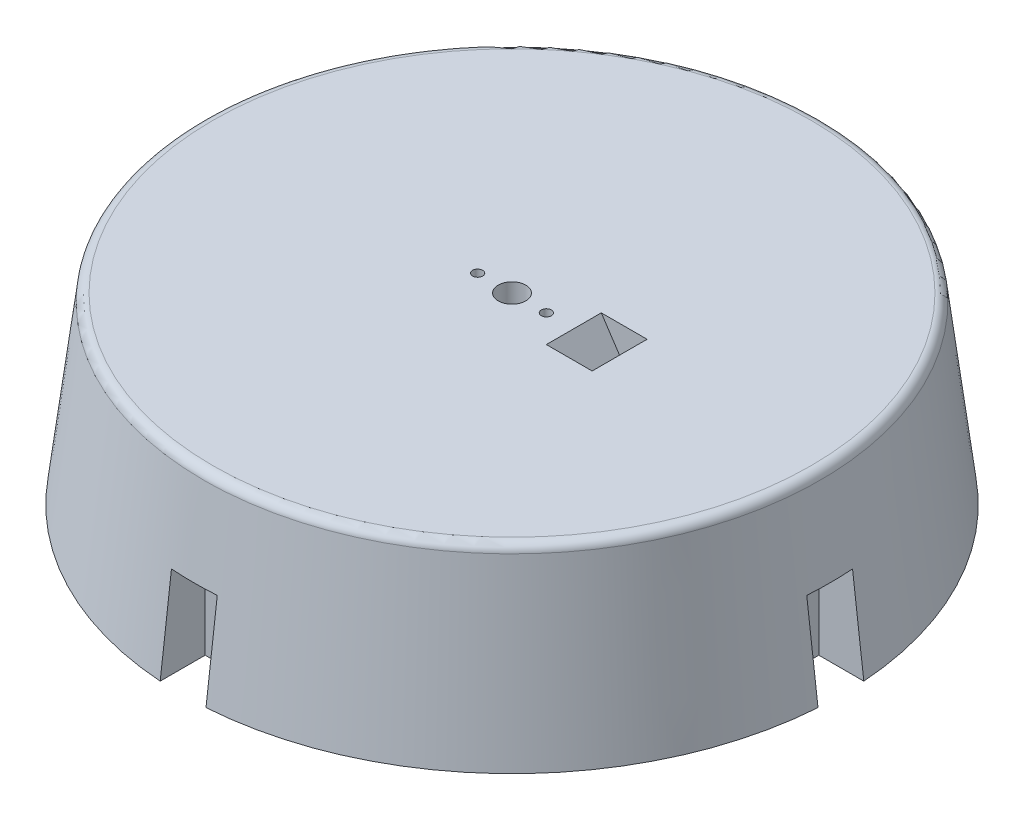
from build123d import *

# Parameters (mm, degrees)
ESQUISSE3_R                  = 72
BOSS_EXTRU_1_DEPTH           = 40
BOSS_EXTRU_1_TAPER           = 7
CONG_2_R                     = 2
ESQUISSE26_R                 = 7.5
ENL_V_MAT_EXTRU_1_DEPTH      = 4
ESQUISSE39_W                 = 10
ESQUISSE39_H                 = 10
ENL_V_MAT_EXTRU_4_DEPTH      = 20
D_GAGEMENT_M2_51_AT_2_COUNT  = 2
D_GAGEMENT_M2_51_AT_2_PITCH  = 10
R_P_TITION_CIRCULAIRE5_COUNT = 4
D_GAGEMENT_M21_D             = 2.2
D_GAGEMENT_M21_DEPTH         = 7
D_GAGEMENT_M21_TIP           = 0.660946681
ENL_V_MAT_EXTRU_2_DEPTH      = 15
ESQUISSE33_R                 = 2
ENL_V_MAT_EXTRU_3_DEPTH      = 105.608795203
ESQUISSE36_W                 = 10
ESQUISSE36_H                 = 12
PASSAGE_DE_CABLE_DEPTH       = 132.153294527
ETOILE_DEPTH                 = 4


with BuildPart() as part:
    # Esquisse3 → Boss.-Extru.1 (new body)
    with BuildSketch(Plane(origin=(0, 0, 0), x_dir=(1, 0, 0), z_dir=(0, 1, 0))):
        Circle(ESQUISSE3_R)
    extrude(amount=BOSS_EXTRU_1_DEPTH, taper=BOSS_EXTRU_1_TAPER)

    # Congé2
    cong_2_edges = [part.edges().sort_by_distance(p)[0] for p in [
        (-67.088617564, 40, 0),
    ]]
    fillet(cong_2_edges, radius=CONG_2_R)

    # Esquisse26 → Enlèv. mat.-Extru.1 (cut)
    with BuildSketch(Plane(origin=(0, 0, 0), x_dir=(-1, 0, 0), z_dir=(0, -1, 0))):
        with Locations(Location((0, 0, 0), (0, 0, 90))):
            Circle(ESQUISSE26_R)
    extrude(amount=-ENL_V_MAT_EXTRU_1_DEPTH, mode=Mode.SUBTRACT)

    # Esquisse39 → Enlèv. mat.-Extru.4 (cut)
    with BuildSketch(Plane.XZ):
        with Locations((67, 0)):
            Rectangle(ESQUISSE39_W, ESQUISSE39_H)
    enl_v_mat_extru_4 = extrude(amount=-ENL_V_MAT_EXTRU_4_DEPTH, mode=Mode.SUBTRACT)

    # Esquisse42 → Dégagement M2.51 (revolve, cut)
    with BuildSketch(Plane(origin=(62, 15, 0), x_dir=(0, 0, -1), z_dir=(0, 1, 0))):
        Polygon((0, 0), (0, 4.811161836), (1.35, 4), (1.35, 0), align=None)
    d_gagement_m2_51 = revolve(axis=Axis((68.35, 15, 0), (-1, 0, 0)), mode=Mode.SUBTRACT)

    # Dégagement M2.51 at 2: Dégagement M2.51 ×2
    with Locations(*[(0, -i * D_GAGEMENT_M2_51_AT_2_PITCH, 0) for i in range(1, D_GAGEMENT_M2_51_AT_2_COUNT)]):
        add(d_gagement_m2_51, mode=Mode.SUBTRACT)

    # Répétition circulaire5: Enlèv. mat.-Extru.4, Dégagement M2.51 ×4 about axis
    r_p_tition_circulaire5_axis = Axis((0, 0, 0), (0, 1, 0))
    add([enl_v_mat_extru_4.rotate(r_p_tition_circulaire5_axis, i * 360 / R_P_TITION_CIRCULAIRE5_COUNT) for i in range(1, R_P_TITION_CIRCULAIRE5_COUNT)], mode=Mode.SUBTRACT)
    add([d_gagement_m2_51.rotate(r_p_tition_circulaire5_axis, i * 360 / R_P_TITION_CIRCULAIRE5_COUNT) for i in range(1, R_P_TITION_CIRCULAIRE5_COUNT)], mode=Mode.SUBTRACT)

    # Répétition circulaire5 copy 1 sketch → Répétition circulaire5 copy 1 (revolve, cut)
    with BuildSketch(Plane(origin=(0, 5, -62), x_dir=(-1, 0, 0), z_dir=(0, 1, 0))):
        Polygon((0, 0), (0, 4.811161836), (1.35, 4), (1.35, 0), align=None)
    revolve(axis=Axis((0, 5, -68.35), (0, 0, 1)), mode=Mode.SUBTRACT)

    # Répétition circulaire5 copy 2 sketch → Répétition circulaire5 copy 2 (revolve, cut)
    with BuildSketch(Plane(origin=(-62, 5, 0), x_dir=(0, 0, 1), z_dir=(0, 1, 0))):
        Polygon((0, 0), (0, 4.811161836), (1.35, 4), (1.35, 0), align=None)
    revolve(axis=Axis((-68.35, 5, 0), (1, 0, 0)), mode=Mode.SUBTRACT)

    # Répétition circulaire5 copy 3 sketch → Répétition circulaire5 copy 3 (revolve, cut)
    with BuildSketch(Plane(origin=(0, 5, 62), x_dir=(1, 0, 0), z_dir=(0, 1, 0))):
        Polygon((0, 0), (0, 4.811161836), (1.35, 4), (1.35, 0), align=None)
    revolve(axis=Axis((0, 5, 68.35), (0, 0, -1)), mode=Mode.SUBTRACT)

    # Dégagement M21
    with Locations(Plane(origin=(0, 40, 0), x_dir=(1, 0, 0), z_dir=(0, 1, 0))):
        with Locations((7.5, 0), (-7.5, 0)):
            Hole(D_GAGEMENT_M21_D / 2, depth=D_GAGEMENT_M21_DEPTH)
            with Locations((0, 0, -(D_GAGEMENT_M21_DEPTH + D_GAGEMENT_M21_TIP / 2))):  # 118° drill point
                Cone(0, D_GAGEMENT_M21_D / 2, D_GAGEMENT_M21_TIP, mode=Mode.SUBTRACT)

    # Esquisse30 → Enlèv. mat.-Extru.2 (cut)
    with BuildSketch(Plane(origin=(0, 40, 0), x_dir=(1, 0, 0), z_dir=(0, 1, 0))):
        with BuildLine():
            ThreePointArc((-3, 0), (0, -3), (3, 0))
            Line((3, 0), (-3, 0))
        make_face()
        with BuildLine():
            Line((-3, 0), (3, 0))
            ThreePointArc((3, 0), (0, 3), (-3, 0))
        make_face()
    extrude(amount=-ENL_V_MAT_EXTRU_2_DEPTH, mode=Mode.SUBTRACT)

    # Esquisse33 → Enlèv. mat.-Extru.3 (cut, through all)
    with BuildSketch(Plane(origin=(0, 25, 0), x_dir=(1, 0, 0), z_dir=(0, 1, 0))):
        with Locations(Location((0, 0, 0), (0, 0, 270))):
            Circle(ESQUISSE33_R)
    extrude(amount=-ENL_V_MAT_EXTRU_3_DEPTH, mode=Mode.SUBTRACT)

    # Esquisse36 → Passage de cable (cut, through all, along a direction that is not the sketch's normal)
    with BuildSketch(Plane.XZ):
        with Locations((45, 0)):
            Rectangle(ESQUISSE36_W, ESQUISSE36_H)
    extrude(amount=-PASSAGE_DE_CABLE_DEPTH, dir=(0.5522931199127548, -0.8336499923211392, 0), mode=Mode.SUBTRACT)

    # Esquisse38 → Etoile (cut)
    with BuildSketch(Plane(origin=(0, 0, 0), x_dir=(-1, 0, 0), z_dir=(0, -1, 0))):
        with BuildLine():
            Line((17.829336699, 2.851269982), (6.749815306, 4.908311464))
            ThreePointArc((6.749815306, 4.908311464), (5.543319697, 5.543319697), (4.908311464, 6.749815306))
            Line((4.908311464, 6.749815306), (2.851269982, 17.829336699))
            ThreePointArc((2.851269982, 17.829336699), (0, 20.199961), (-2.851269982, 17.829336699))
            Line((-2.851269982, 17.829336699), (-4.908311464, 6.749815306))
            ThreePointArc((-4.908311464, 6.749815306), (-5.543319697, 5.543319697), (-6.749815306, 4.908311464))
            Line((-6.749815306, 4.908311464), (-17.829336699, 2.851269982))
            ThreePointArc((-17.829336699, 2.851269982), (-20.199961, 0), (-17.829336699, -2.851269982))
            Line((-17.829336699, -2.851269982), (-6.749815306, -4.908311464))
            ThreePointArc((-6.749815306, -4.908311464), (-5.543319697, -5.543319697), (-4.908311464, -6.749815306))
            Line((-4.908311464, -6.749815306), (-2.851269982, -17.829336699))
            ThreePointArc((-2.851269982, -17.829336699), (0, -20.199961), (2.851269982, -17.829336699))
            Line((2.851269982, -17.829336699), (4.908311464, -6.749815306))
            ThreePointArc((4.908311464, -6.749815306), (5.543319697, -5.543319697), (6.749815306, -4.908311464))
            Line((6.749815306, -4.908311464), (17.829336699, -2.851269982))
            ThreePointArc((17.829336699, -2.851269982), (20.199961, 0), (17.829336699, 2.851269982))
        make_face()
    extrude(amount=-ETOILE_DEPTH, mode=Mode.SUBTRACT)


solid = part.part
